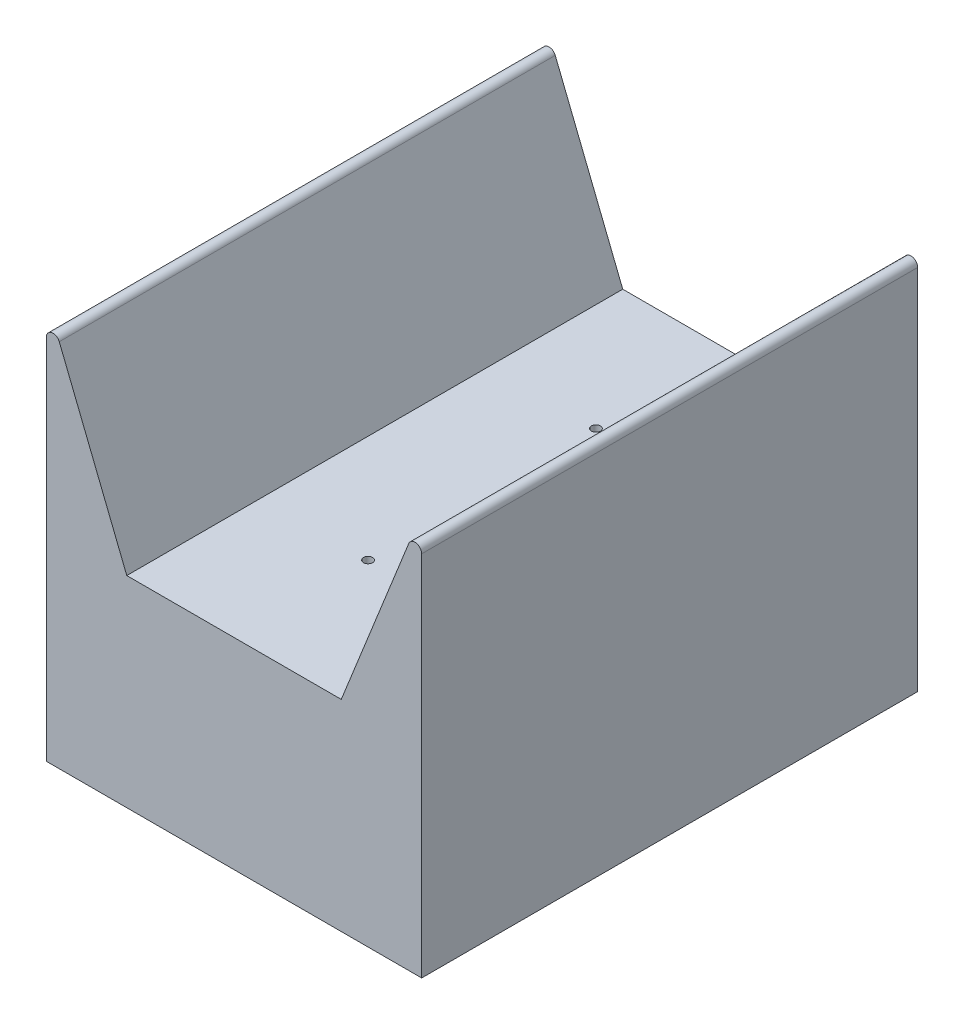
from build123d import *

# Parameters (mm, degrees)
ESQUISSE1_W             = 2
ESQUISSE1_H             = 37
ESQUISSE1_W_2           = 24
BOSS_EXTRU_1_DEPTH      = 30
ENL_V_MAT_EXTRU_3_DEPTH = 40
CONG_1_R                = 0.5
ESQUISSE4_R             = 0.34
ENL_V_MAT_EXTRU_4_DEPTH = 12
ESQUISSE5_R             = 1.5
ENL_V_MAT_EXTRU_6_DEPTH = 16


with BuildPart() as part:
    # Esquisse1 → Boss.-Extru.1 (new body)
    with BuildSketch(Plane(origin=(0, 0, 0), x_dir=(1, 0, 0), z_dir=(0, 1, 0))):
        with Locations((-13, 0)):
            Rectangle(ESQUISSE1_W, ESQUISSE1_H)
        Rectangle(ESQUISSE1_W_2, ESQUISSE1_H)
        with Locations((13, 0)):
            Rectangle(ESQUISSE1_W, ESQUISSE1_H)
    extrude(amount=BOSS_EXTRU_1_DEPTH)

    # Esquisse3 → Enlèv. mat.-Extru.3 (cut)
    with BuildSketch(Plane(origin=(0, 0, -18.5), x_dir=(-1, 0, 0), z_dir=(0, 0, -1))):
        Polygon((-8, 15), (8, 15), (14, 30), (-14, 30), align=None)
    extrude(amount=-ENL_V_MAT_EXTRU_3_DEPTH, mode=Mode.SUBTRACT)

    # Congé1
    cong_1_edges = [part.edges().sort_by_distance(p)[0] for p in [
        (14, 30, 0),
        (-14, 30, 0),
    ]]
    fillet(cong_1_edges, radius=CONG_1_R)

    # Esquisse4 → Enlèv. mat.-Extru.4 (cut)
    with BuildSketch(Plane(origin=(0, 15, 0), x_dir=(1, 0, 0), z_dir=(0, 1, 0))):
        with Locations(Location((0, 8.5, 0), (0, 0, 180))):
            Circle(ESQUISSE4_R)
        with Locations(Location((0, -8.5, 0), (0, 0, 180))):
            Circle(ESQUISSE4_R)
    extrude(amount=-ENL_V_MAT_EXTRU_4_DEPTH, mode=Mode.SUBTRACT)

    # Esquisse5 → Enlèv. mat.-Extru.6 (cut)
    with BuildSketch(Plane.ZY.offset(14)):
        with Locations((-8.5, 3)):
            Circle(ESQUISSE5_R)
        with Locations((8.5, 3)):
            Circle(ESQUISSE5_R)
    extrude(amount=-ENL_V_MAT_EXTRU_6_DEPTH, mode=Mode.SUBTRACT)


solid = part.part
